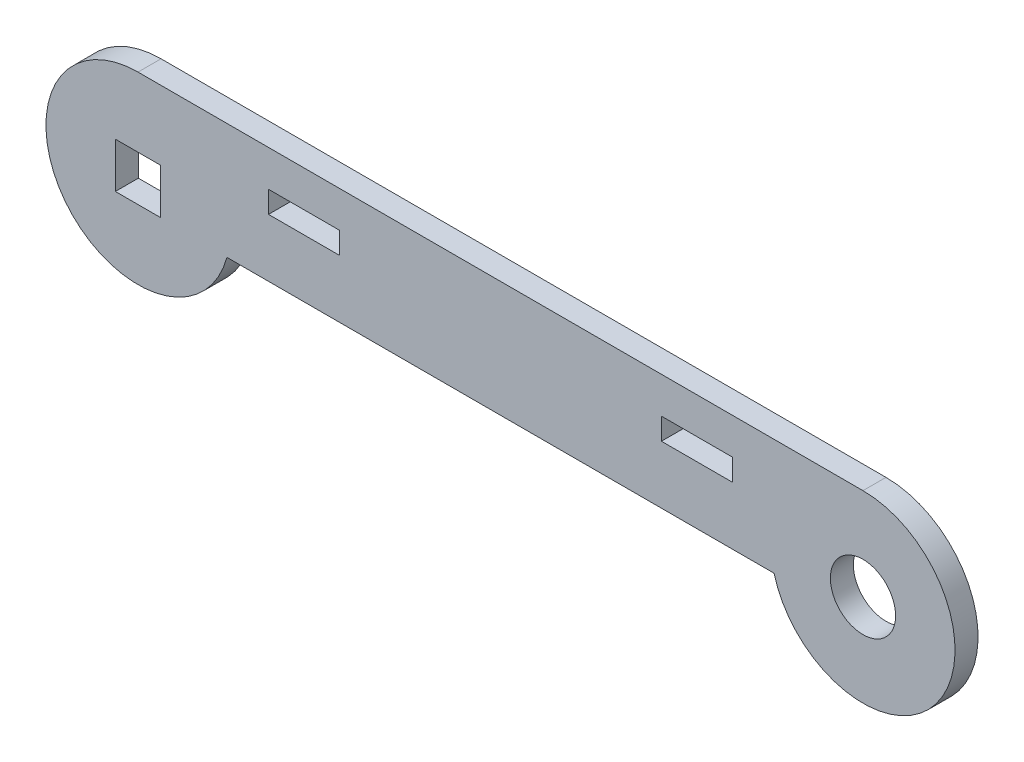
from build123d import *

# Parameters (mm, degrees)
SKETCH1_W           = 4.9
SKETCH1_H           = 1.5
SKETCH1_R           = 6.35
SKETCH1_W_2         = 3.125
SKETCH1_H_2         = 3.125
SKETCH1_R_2         = 2.25
BOSS_EXTRUDE1_DEPTH = 1.5875


with BuildPart() as part:
    # Sketch1 → Boss-Extrude1 (new body)
    # profile 1 of 3: a face of its own
    with BuildSketch(Plane.XY):
        with BuildLine():
            Line((50, 6.35), (0, 6.35))
            ThreePointArc((0, 6.35), (4.490128061, 4.490128061), (6.35, 0))
            ThreePointArc((6.35, 0), (6.295234812, -0.83217706), (6.131883887, -1.65))
            Line((6.131883887, -1.65), (43.868116113, -1.65))
            ThreePointArc((43.868116113, -1.65), (44.960158733, 3.862965182), (50, 6.35))
        make_face()
        with Locations((11.45, 3.1)):
            Rectangle(SKETCH1_W, SKETCH1_H, mode=Mode.SUBTRACT)
        with Locations((38.55, 3.1)):
            Rectangle(SKETCH1_W, SKETCH1_H, mode=Mode.SUBTRACT)
    # profile 2 of 3: a face of its own
    with BuildSketch(Plane.XY):
        Circle(SKETCH1_R)
        Rectangle(SKETCH1_W_2, SKETCH1_H_2, mode=Mode.SUBTRACT)
    # profile 3 of 3: a face of its own
    with BuildSketch(Plane.XY):
        with Locations((50, 0)):
            Circle(SKETCH1_R)
        with Locations((50, 0)):
            Circle(SKETCH1_R_2, mode=Mode.SUBTRACT)
    extrude(amount=BOSS_EXTRUDE1_DEPTH)


solid = part.part
